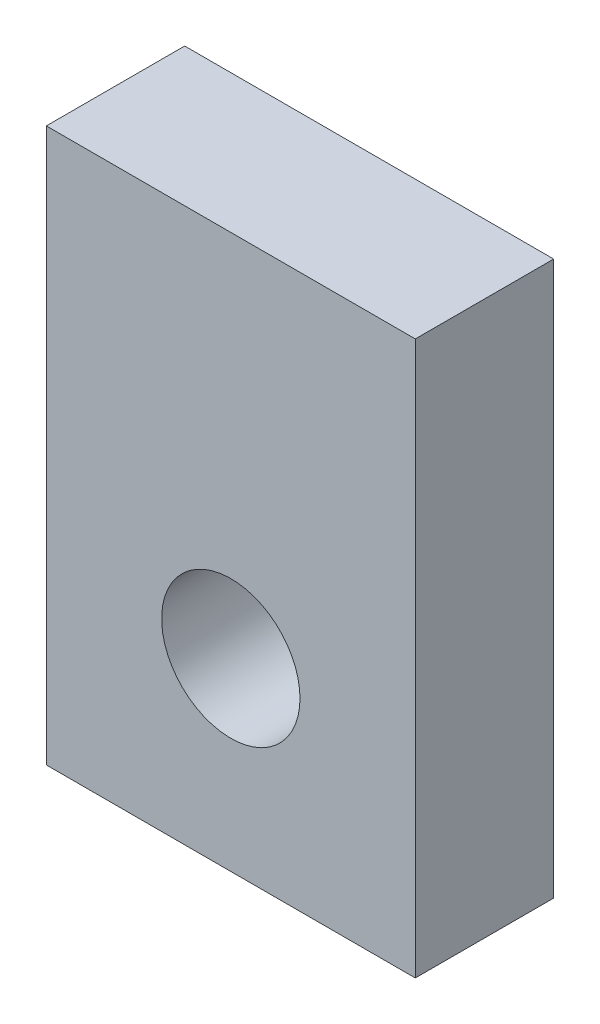
from build123d import *

# Parameters (mm, degrees)
SKETCH_1_W          = 8
SKETCH_1_H          = 12
EXTRUDE_1_DEPTH     = 3
SKETCH_2_R          = 1.5
CUT_EXTRUDE_1_DEPTH = 15.730919863


with BuildPart() as part:
    # Эскиз1 → Бобышка-Вытянуть1 (new body)
    with BuildSketch(Plane.XY):
        with Locations((4, 6)):
            Rectangle(SKETCH_1_W, SKETCH_1_H)
    extrude(amount=EXTRUDE_1_DEPTH)

    # Эскиз2 → Вырез-Вытянуть1 (cut, through all)
    with BuildSketch(Plane.XY.offset(3)):
        with Locations((4, 4)):
            Circle(SKETCH_2_R)
    extrude(amount=-CUT_EXTRUDE_1_DEPTH, mode=Mode.SUBTRACT)


solid = part.part
